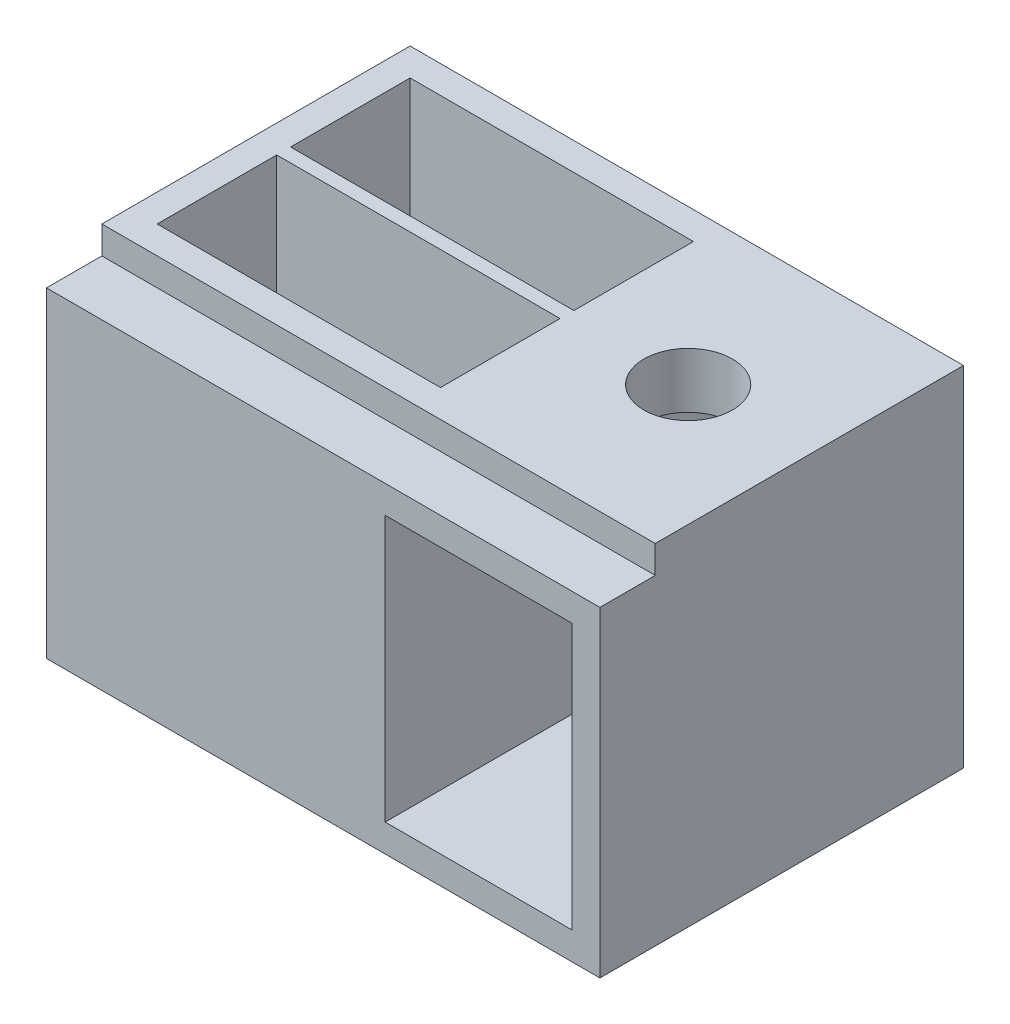
from build123d import *

# Parameters (mm, degrees)
SKETCH1_W            = 63.5
SKETCH1_H            = 44.45
SKETCH1_W_2          = 32.512
SKETCH1_H_2          = 13.716
BOSS_EXTRUDE1_DEPTH  = 40.005
SKETCH2_W            = 32.512
SKETCH2_H            = 13.716
BOSS_EXTRUDE2_DEPTH  = 2.54
CUT_EXTRUDE1_DEPTH   = 36.83
BOSS_EXTRUDE8_DEPTH  = 6.35
BOSS_EXTRUDE9_REACH  = 92.627
SKETCH10_W           = 21.463
SKETCH10_H           = 3.175
SKETCH11_W           = 9.0805
SKETCH11_H           = 36.83
CUT_EXTRUDE2_DEPTH   = 88.226443955
SKETCH12_W           = 21.463
SKETCH12_H           = 30.48
SKETCH12_R           = 5.08
BOSS_EXTRUDE10_DEPTH = 2.54
SKETCH13_W           = 24.638
SKETCH13_H           = 35.3695
BOSS_EXTRUDE11_DEPTH = 3.175
SKETCH14_R           = 5.08
CUT_EXTRUDE3_DEPTH   = 6.35


with BuildPart() as part:
    # Sketch1 → Boss-Extrude1 (new body)
    with BuildSketch(Plane(origin=(0, 0, 0), x_dir=(1, 0, 0), z_dir=(0, 1, 0))):
        with Locations((31.75, 22.225)):
            Rectangle(SKETCH1_W, SKETCH1_H)
        with Locations((19.431, 25.3365)):
            Rectangle(SKETCH1_W_2, SKETCH1_H_2, mode=Mode.SUBTRACT)
        with Locations((19.431, 10.033)):
            Rectangle(SKETCH1_W_2, SKETCH1_H_2, mode=Mode.SUBTRACT)
    extrude(amount=BOSS_EXTRUDE1_DEPTH)

    # Sketch2 → Boss-Extrude2 (add)
    with BuildSketch(Plane.XZ):
        with Locations((19.431, -10.033)):
            Rectangle(SKETCH2_W, SKETCH2_H)
        with Locations((19.431, -25.3365)):
            Rectangle(SKETCH2_W, SKETCH2_H)
    extrude(amount=-BOSS_EXTRUDE2_DEPTH)

    # Sketch3 → Cut-Extrude1 (cut)
    with BuildSketch(Plane(origin=(0, 40.005, 0), x_dir=(1, 0, 0), z_dir=(0, 1, 0))):
        Polygon((3.175, 35.3695), (35.687, 35.3695), (38.862, 35.3695), (38.862, 32.1945), (38.862, 18.4785), (38.862, 0), (63.5, 0), (63.5, 44.45), (0, 44.45), (0, 35.3695), align=None)
    extrude(amount=-CUT_EXTRUDE1_DEPTH, mode=Mode.SUBTRACT)

    # Sketch9 → Boss-Extrude8 (add)
    with BuildSketch(Plane.XY):
        Polygon((38.862, 36.83), (0, 36.83), (0, 0), (63.5, 0), (63.5, 3.175), (38.862, 3.175), align=None)
    extrude(amount=BOSS_EXTRUDE8_DEPTH)

    # Boss-Extrude9: up to this face of the body (flat: up to its plane)
    boss_extrude9_end = Plane(part.part.faces().sort_by_distance((31.75, 1.5875, -44.45))[0])
    # Sketch10 → Boss-Extrude9 (add, up to the picked face)
    with BuildSketch(Plane.XY.offset(6.35), mode=Mode.PRIVATE) as boss_extrude9_sk1:
        Polygon((60.325, 3.175), (63.5, 3.175), (63.5, 36.83), (60.325, 36.83), (60.325, 33.655), (60.325, 30.48), align=None)
    boss_extrude9_tool1 = split(extrude(boss_extrude9_sk1.sketch, amount=-BOSS_EXTRUDE9_REACH, mode=Mode.PRIVATE), bisect_by=boss_extrude9_end, keep=Keep.BOTH, mode=Mode.PRIVATE)
    # Sketch10 → Boss-Extrude9 (add, up to the picked face)
    with BuildSketch(Plane.XY.offset(6.35), mode=Mode.PRIVATE) as boss_extrude9_sk2:
        with Locations((49.5935, 35.2425)):
            Rectangle(SKETCH10_W, SKETCH10_H)
    boss_extrude9_tool2 = split(extrude(boss_extrude9_sk2.sketch, amount=-BOSS_EXTRUDE9_REACH, mode=Mode.PRIVATE), bisect_by=boss_extrude9_end, keep=Keep.BOTH, mode=Mode.PRIVATE)
    add(boss_extrude9_tool1.solids().sort_by(Axis((61.9125, 20.0025, 6.35), (0, 0, -1)))[0])
    add(boss_extrude9_tool2.solids().sort_by(Axis((49.5935, 35.2425, 6.35), (0, 0, -1)))[0])

    # Sketch11 → Cut-Extrude2 (cut, through all)
    with BuildSketch(Plane.ZY):
        with Locations((-39.90975, 18.415)):
            Rectangle(SKETCH11_W, SKETCH11_H)
    extrude(amount=-CUT_EXTRUDE2_DEPTH, mode=Mode.SUBTRACT)

    # Sketch12 → Boss-Extrude10 (add)
    with BuildSketch(Plane(origin=(0, 0, -35.3695), x_dir=(-1, 0, 0), z_dir=(0, 0, -1))):
        with Locations((-49.5935, 18.415)):
            Rectangle(SKETCH12_W, SKETCH12_H)
        with Locations((-49.5935, 18.415)):
            Circle(SKETCH12_R, mode=Mode.SUBTRACT)
    extrude(amount=-BOSS_EXTRUDE10_DEPTH)

    # Sketch13 → Boss-Extrude11 (add)
    with BuildSketch(Plane(origin=(0, 36.83, 0), x_dir=(1, 0, 0), z_dir=(0, 1, 0))):
        with Locations((51.181, 17.68475)):
            Rectangle(SKETCH13_W, SKETCH13_H)
    extrude(amount=BOSS_EXTRUDE11_DEPTH)

    # Sketch14 → Cut-Extrude3 (cut)
    with BuildSketch(Plane(origin=(0, 40.005, 0), x_dir=(1, 0, 0), z_dir=(0, 1, 0))):
        with Locations(Location((49.5935, 17.68475, 0), (0, 0, 270))):
            Circle(SKETCH14_R)
    extrude(amount=-CUT_EXTRUDE3_DEPTH, mode=Mode.SUBTRACT)


solid = part.part
